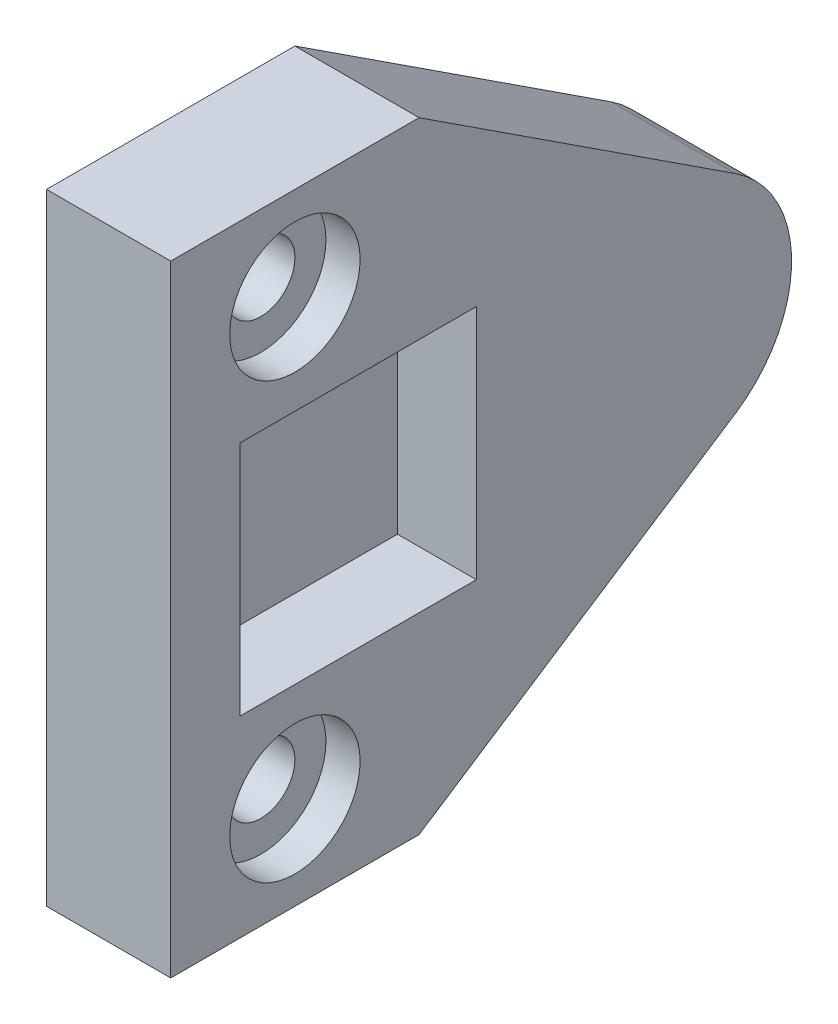
from build123d import *

# Parameters (mm, degrees)
SKETCH1_W                       = 20
SKETCH1_H                       = 50
BOSS_EXTRUDE1_DEPTH             = 10
CBORE_FOR_M5_SBHCS1_D           = 5.5
CBORE_FOR_M5_SBHCS1_CBORE_D     = 10.5
CBORE_FOR_M5_SBHCS1_CBORE_DEPTH = 2.75
SKETCH5_W                       = 19.05
SKETCH5_H                       = 19.05
CUT_EXTRUDE1_DEPTH              = 6.35


with BuildPart() as part:
    # Sketch1 → Boss-Extrude1 (new body)
    with BuildSketch(Plane(origin=(0, 0, 0), x_dir=(0, 0, -1), z_dir=(1, 0, 0))):
        with Locations((-10, 0)):
            Rectangle(SKETCH1_W, SKETCH1_H)
        with BuildLine():
            ThreePointArc((25.466783574, 8.373426859), (30, 0), (25.466783574, -8.373426859))
            Line((25.466783574, -8.373426859), (0, -25))
            Line((0, -25), (0, 25))
            Line((0, 25), (25.466783574, 8.373426859))
        make_face()
    extrude(amount=BOSS_EXTRUDE1_DEPTH)

    # CBORE for M5 SBHCS1 (through all)
    with Locations(Plane(origin=(10, 0, 0), x_dir=(0, 0, -1), z_dir=(1, 0, 0))):
        with Locations((-10, 17.5), (-10, -17.5)):
            CounterBoreHole(CBORE_FOR_M5_SBHCS1_D / 2, CBORE_FOR_M5_SBHCS1_CBORE_D / 2, CBORE_FOR_M5_SBHCS1_CBORE_DEPTH)

    # Sketch5 → Cut-Extrude1 (cut)
    with BuildSketch(Plane(origin=(10, 0, 0), x_dir=(0, 0, -1), z_dir=(1, 0, 0))):
        with Locations((-4.915565879, 0)):
            Rectangle(SKETCH5_W, SKETCH5_H)
    extrude(amount=-CUT_EXTRUDE1_DEPTH, mode=Mode.SUBTRACT)


solid = part.part
